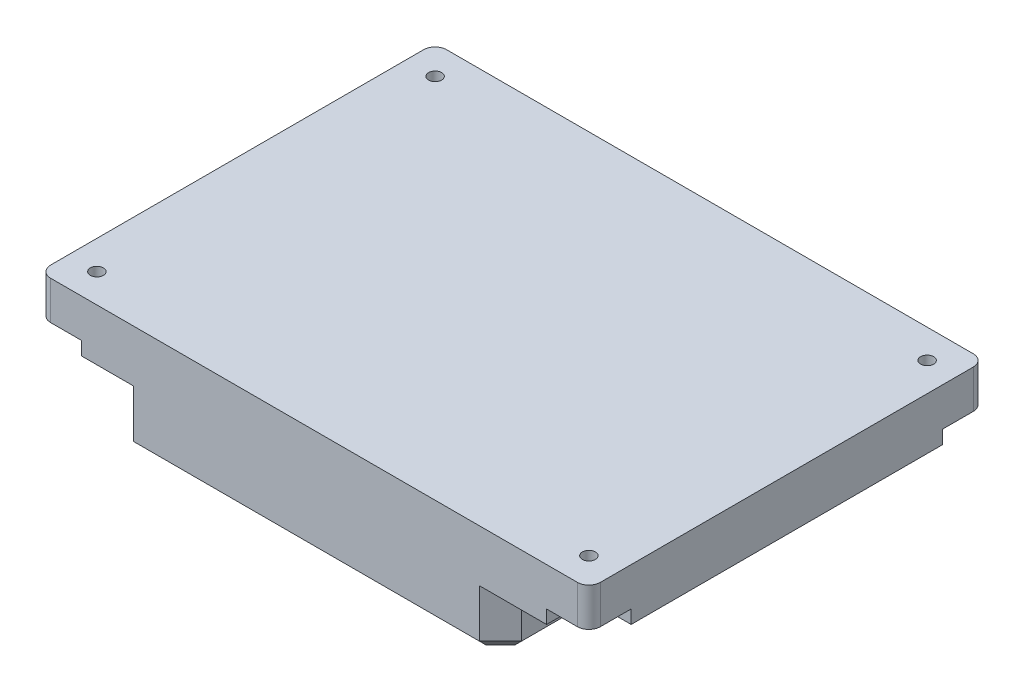
from build123d import *

# Parameters (mm, degrees)
SKETCH1_R           = 1.7
BOSS_EXTRUDE1_DEPTH = 13.5
CUT_EXTRUDE2_START  = -3.5
CUT_EXTRUDE2_DEPTH  = 3.5
BOSS_EXTRUDE2_DEPTH = 15.5
CHAMFER1_SIZE       = 3


with BuildPart() as part:
    # Sketch1 → Boss-Extrude1 (new body)
    with BuildSketch(Plane(origin=(0, 3, 0), x_dir=(1, 0, 0), z_dir=(0, 1, 0))):
        with BuildLine():
            Line((71.5, -48.5), (71.5, 48.5))
            ThreePointArc((71.5, 48.5), (70.621320344, 50.621320344), (68.5, 51.5))
            Line((68.5, 51.5), (-68.5, 51.5))
            ThreePointArc((-68.5, 51.5), (-70.621320344, 50.621320344), (-71.5, 48.5))
            Line((-71.5, 48.5), (-71.5, -48.5))
            ThreePointArc((-71.5, -48.5), (-70.621320344, -50.621320344), (-68.5, -51.5))
            Line((-68.5, -51.5), (68.5, -51.5))
            ThreePointArc((68.5, -51.5), (70.621320344, -50.621320344), (71.5, -48.5))
        make_face()
        with Locations(Location((-64, 44, 0), (0, 0, 90))):
            Circle(SKETCH1_R, mode=Mode.SUBTRACT)
        with Locations(Location((-64, -44, 0), (0, 0, 90))):
            Circle(SKETCH1_R, mode=Mode.SUBTRACT)
        with Locations(Location((64, -44, 0), (0, 0, 90))):
            Circle(SKETCH1_R, mode=Mode.SUBTRACT)
        with Locations(Location((64, 44, 0), (0, 0, 90))):
            Circle(SKETCH1_R, mode=Mode.SUBTRACT)
    extrude(amount=-BOSS_EXTRUDE1_DEPTH)

    # Sketch2 → Cut-Extrude2 (cut)
    with BuildSketch(Plane.XZ.offset(10.5).offset(CUT_EXTRUDE2_START)):
        with BuildLine():
            Line((-71.5, -40.5), (-63, -40.5))
            Line((-63, -40.5), (-60.5, -43))
            Line((-60.5, -43), (-60.5, -51.5))
            Line((-60.5, -51.5), (-68.5, -51.5))
            ThreePointArc((-68.5, -51.5), (-70.621320344, -50.621320344), (-71.5, -48.5))
            Line((-71.5, -48.5), (-71.5, -40.5))
        make_face()
        with BuildLine():
            Line((-71.5, 40.5), (-63, 40.5))
            Line((-63, 40.5), (-60.5, 43))
            Line((-60.5, 43), (-60.5, 51.5))
            Line((-60.5, 51.5), (-68.5, 51.5))
            ThreePointArc((-68.5, 51.5), (-70.621320344, 50.621320344), (-71.5, 48.5))
            Line((-71.5, 48.5), (-71.5, 40.5))
        make_face()
        with BuildLine():
            Line((60.5, 51.5), (60.5, 43))
            Line((60.5, 43), (63, 40.5))
            Line((63, 40.5), (71.5, 40.5))
            Line((71.5, 40.5), (71.5, 48.5))
            ThreePointArc((71.5, 48.5), (70.621320344, 50.621320344), (68.5, 51.5))
            Line((68.5, 51.5), (60.5, 51.5))
        make_face()
        with BuildLine():
            Line((60.5, -51.5), (60.5, -43))
            Line((60.5, -43), (63, -40.5))
            Line((63, -40.5), (71.5, -40.5))
            Line((71.5, -40.5), (71.5, -48.5))
            ThreePointArc((71.5, -48.5), (70.621320344, -50.621320344), (68.5, -51.5))
            Line((68.5, -51.5), (60.5, -51.5))
        make_face()
    extrude(amount=CUT_EXTRUDE2_DEPTH, mode=Mode.SUBTRACT)

    # Sketch3 → Boss-Extrude2 (add)
    with BuildSketch(Plane.XZ.offset(10.5)):
        Polygon((-52.5, 46), (-52.5, -32), (-47, -37.5), (43, -37.5), (48.5, -32), (48.5, 46), (43, 51.5), (-47, 51.5), align=None)
    extrude(amount=BOSS_EXTRUDE2_DEPTH)

    # Chamfer1
    chamfer1_edges = [part.edges().sort_by_distance(p)[0] for p in [
        (-2, -26, -37.5),
        (-49.75, -26, -34.75),
        (48.5, -26, 7),
        (45.75, -26, -34.75),
        (45.75, -26, 48.75),
        (-2, -26, 51.5),
        (-49.75, -26, 48.75),
        (-52.5, -26, 7),
    ]]
    chamfer(chamfer1_edges, length=CHAMFER1_SIZE)


solid = part.part
